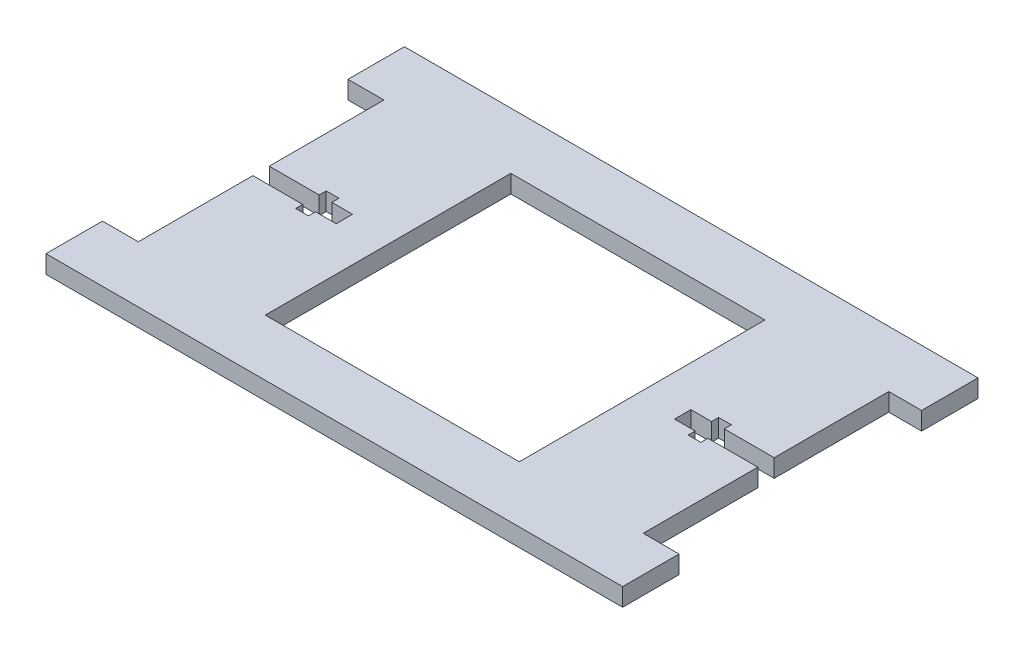
from build123d import *

# Parameters (mm, degrees)
SKETCH1_W      = 45
SKETCH1_H      = 43.5
EXTRUDE1_DEPTH = 3.175


with BuildPart() as part:
    # Sketch1 → Extrude1 (new body)
    with BuildSketch(Plane(origin=(0, 0, 0), x_dir=(1, 0, 0), z_dir=(0, 1, 0))):
        Polygon((37.227457893, -45.375264395), (37.227457893, -35.375264395), (30.877457893, -35.375264395), (30.877457893, -15.075264395), (22.037457893, -15.075264395), (22.037457893, -16.325264395), (19.787457893, -16.325264395), (19.787457893, -15.075264395), (16.127457893, -15.075264395), (16.127457893, -12.175264395), (19.787457893, -12.175264395), (19.787457893, -10.925264395), (22.037457893, -10.925264395), (22.037457893, -12.175264395), (30.877457893, -12.175264395), (30.877457893, 8.124735605), (36.682921964, 8.124735605), (36.682921964, 18.124735605), (-64.917078036, 18.124735605), (-64.917078036, 8.124735605), (-58.567078036, 8.124735605), (-58.567078036, -12.175264395), (-49.727078036, -12.175264395), (-49.727078036, -10.925264395), (-47.477078036, -10.925264395), (-47.477078036, -12.175264395), (-43.817078036, -12.175264395), (-43.817078036, -15.075264395), (-47.477078036, -15.075264395), (-47.477078036, -16.325264395), (-49.727078036, -16.325264395), (-49.727078036, -15.075264395), (-58.567078036, -15.075264395), (-58.567078036, -35.375264395), (-64.917078036, -35.375264395), (-64.917078036, -45.375264395), align=None)
        with Locations((-13.572542107, -13.625264395)):
            Rectangle(SKETCH1_W, SKETCH1_H, mode=Mode.SUBTRACT)
    extrude(amount=EXTRUDE1_DEPTH)


solid = part.part
